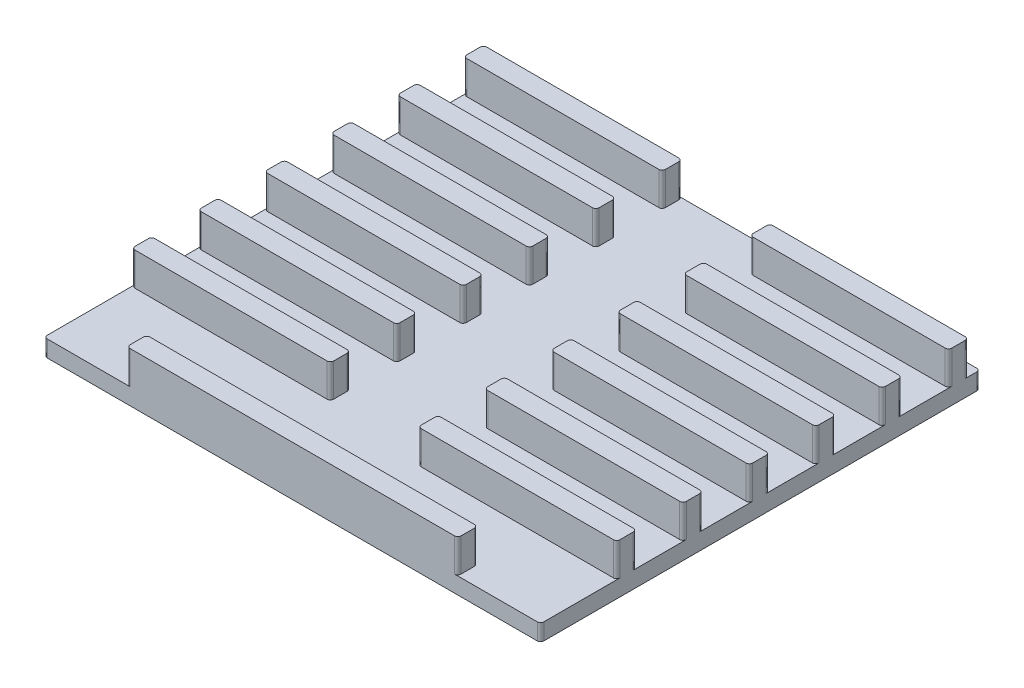
from build123d import *

# Parameters (mm, degrees)
SKETCH1_W           = 150
SKETCH1_H           = 132.74
BOSS_EXTRUDE1_DEPTH = 5
SKETCH1_3_W         = 60
SKETCH1_3_H         = 6
SKETCH1_3_W_2       = 100
BOSS_EXTRUDE2_DEPTH = 15
FILLET1_R           = 1


with BuildPart() as part:
    # Sketch1 → Boss-Extrude1 (new body)
    with BuildSketch(Plane(origin=(0, 0, 0), x_dir=(1, 0, 0), z_dir=(0, 1, 0))):
        with Locations((0, -3.226)):
            Rectangle(SKETCH1_W, SKETCH1_H)
    extrude(amount=BOSS_EXTRUDE1_DEPTH)

    # Sketch1<3> → Boss-Extrude2 (add)
    with BuildSketch(Plane(origin=(0, 0, 0), x_dir=(1, 0, 0), z_dir=(0, 1, 0))):
        with Locations((-45, 60.144)):
            Rectangle(SKETCH1_3_W, SKETCH1_3_H)
        with Locations((-45, 40.096)):
            Rectangle(SKETCH1_3_W, SKETCH1_3_H)
        with Locations((-45, 20.048)):
            Rectangle(SKETCH1_3_W, SKETCH1_3_H)
        with Locations((-45, 0)):
            Rectangle(SKETCH1_3_W, SKETCH1_3_H)
        with Locations((45, 56.644)):
            Rectangle(SKETCH1_3_W, SKETCH1_3_H)
        with Locations((45, 36.596)):
            Rectangle(SKETCH1_3_W, SKETCH1_3_H)
        with Locations((45, 16.548)):
            Rectangle(SKETCH1_3_W, SKETCH1_3_H)
        with Locations((45, -3.5)):
            Rectangle(SKETCH1_3_W, SKETCH1_3_H)
        with Locations((-45, -20.048)):
            Rectangle(SKETCH1_3_W, SKETCH1_3_H)
        with Locations((-45, -40.096)):
            Rectangle(SKETCH1_3_W, SKETCH1_3_H)
        with Locations((0, -66.596)):
            Rectangle(SKETCH1_3_W_2, SKETCH1_3_H)
        with Locations((45, -23.548)):
            Rectangle(SKETCH1_3_W, SKETCH1_3_H)
        with Locations((45, -43.596)):
            Rectangle(SKETCH1_3_W, SKETCH1_3_H)
    extrude(amount=BOSS_EXTRUDE2_DEPTH)

    # Fillet1
    fillet1_edges = [part.edges().sort_by_distance(p)[0] for p in [
        (75, 10, 40.596),
        (75, 10, 20.548),
        (75, 10, 0.5),
        (75, 10, -19.548),
        (75, 10, -59.644),
        (75, 10, -39.596),
        (-15, 10, -63.144),
        (-15, 10, -43.096),
        (-15, 10, -23.048),
        (-15, 10, -3),
        (-15, 10, 17.048),
        (-15, 10, 37.096),
        (50, 10, 63.596),
        (50, 10, 69.596),
        (-15, 10, 43.096),
        (-15, 10, 23.048),
        (-15, 10, 3),
        (-15, 10, -17.048),
        (-15, 10, -37.096),
        (-15, 10, -57.144),
        (75, 10, -53.644),
        (75, 10, -33.596),
        (75, 10, -13.548),
        (75, 10, 6.5),
        (75, 10, 26.548),
        (75, 10, 46.596),
        (15, 10, 46.596),
        (15, 10, 40.596),
        (15, 10, 26.548),
        (15, 10, 20.548),
        (15, 10, 0.5),
        (15, 10, 6.5),
        (15, 10, -13.548),
        (15, 10, -19.548),
        (15, 10, -33.596),
        (15, 10, -39.596),
        (15, 10, -53.644),
        (15, 10, -59.644),
        (-50, 10, 69.596),
        (-50, 10, 63.596),
        (-75, 7.5, -63.144),
        (75, 2.5, -63.144),
        (75, 2.5, 69.596),
        (-75, 2.5, 69.596),
        (-75, 10, 43.096),
        (-75, 10, 37.096),
        (-75, 10, 23.048),
        (-75, 10, 17.048),
        (-75, 10, 3),
        (-75, 10, -3),
        (-75, 10, -17.048),
        (-75, 10, -23.048),
        (-75, 10, -37.096),
        (-75, 10, -43.096),
        (-75, 10, -57.144),
    ]]
    fillet(fillet1_edges, radius=FILLET1_R)


solid = part.part
